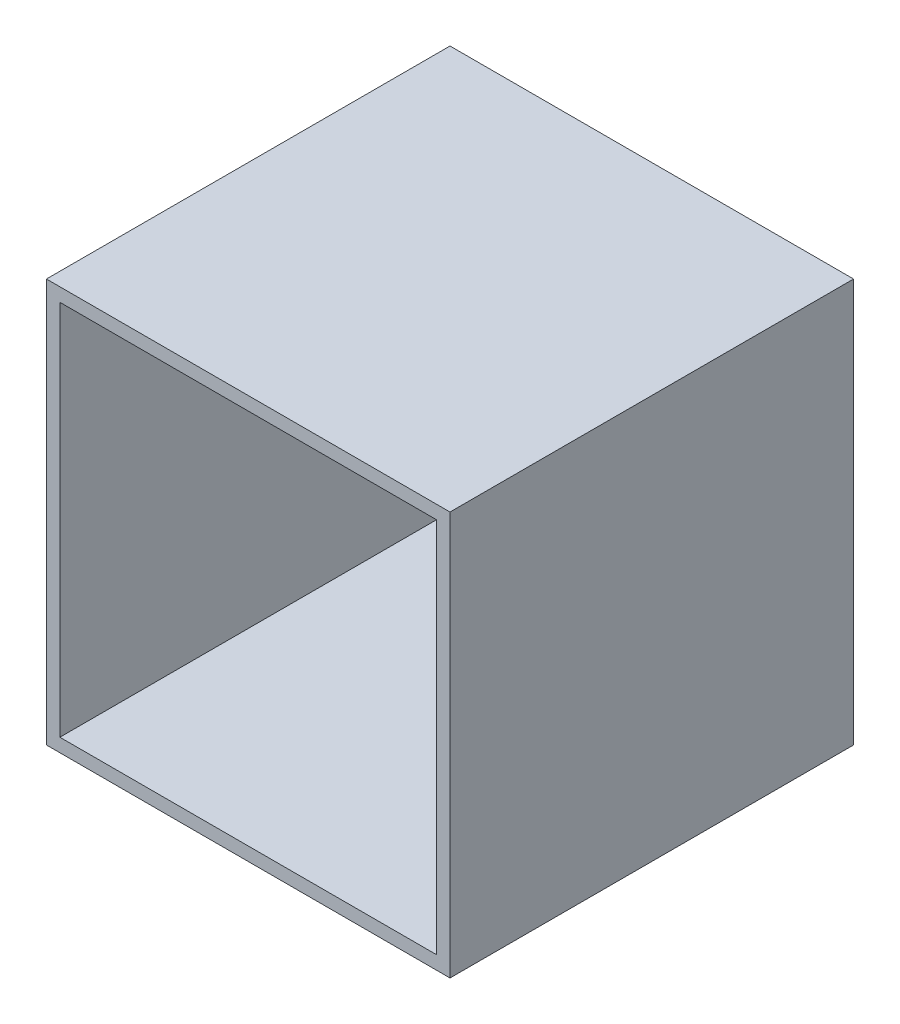
from build123d import *

# Parameters (mm, degrees)
SKETCH1_W               = 76.2
SKETCH1_H               = 76.2
BOX_DEPTH               = 76.2
HOLLOW_IT_T             = -2.54
SKETCH2_W               = 6.35
SKETCH2_H               = 63.5
SLIDER_TRACK_DEPTH      = 2.54
SKETCH4_R               = 6.35
BUTTON_LARGE_RING_DEPTH = 1.27
SKETCH5_R               = 3.175
BUTTON_SMALL_HOLE_DEPTH = 1.27
DPAD_LARGE_SHAPE_DEPTH  = 1.27
SKETCH7_R               = 1.397
DPAD_TINY_HOLES_DEPTH   = 1.27
SKETCH8_R               = 12.7
DIAL_LARGE_RING_DEPTH   = 1.27
SKETCH9_R               = 3.175
DIAL_SMALL_HOLE_DEPTH   = 1.27


with BuildPart() as part:
    # Sketch1 → box (new body)
    with BuildSketch(Plane(origin=(0, 0, 0), x_dir=(1, 0, 0), z_dir=(0, 1, 0))):
        Rectangle(SKETCH1_W, SKETCH1_H)
    extrude(amount=BOX_DEPTH)

    # hollow it
    hollow_it_openings = [part.faces().sort_by_distance(p)[0] for p in [
        (0, 38.1, 38.1),
    ]]
    offset(amount=HOLLOW_IT_T, openings=hollow_it_openings, kind=Kind.INTERSECTION)

    # Sketch2 → slider track (cut)
    with BuildSketch(Plane(origin=(0, 0, -38.1), x_dir=(-1, 0, 0), z_dir=(0, 0, -1))):
        with Locations((-24.765, 38.1)):
            Rectangle(SKETCH2_W, SKETCH2_H)
    extrude(amount=-SLIDER_TRACK_DEPTH, mode=Mode.SUBTRACT)

    # Sketch4 → button large ring (cut)
    with BuildSketch(Plane(origin=(0, 0, -38.1), x_dir=(-1, 0, 0), z_dir=(0, 0, -1))):
        with Locations((0, 57.15)):
            Circle(SKETCH4_R)
    extrude(amount=-BUTTON_LARGE_RING_DEPTH, mode=Mode.SUBTRACT)

    # Sketch5 → button small hole (cut)
    with BuildSketch(Plane(origin=(0, 0, -36.83), x_dir=(-1, 0, 0), z_dir=(0, 0, -1))):
        with Locations((0, 57.15)):
            Circle(SKETCH5_R)
    extrude(amount=-BUTTON_SMALL_HOLE_DEPTH, mode=Mode.SUBTRACT)

    # Sketch6 → dpad large shape (cut)
    with BuildSketch(Plane(origin=(0, 0, -38.1), x_dir=(-1, 0, 0), z_dir=(0, 0, -1))):
        Polygon((-3.297705804, 25.4), (-3.297705804, 31.75), (3.052294196, 31.75), (3.052294196, 25.4), (9.402294196, 25.4), (9.402294196, 19.05), (3.052294196, 19.05), (3.052294196, 12.7), (-3.297705804, 12.7), (-3.297705804, 19.05), (-9.647705804, 19.05), (-9.647705804, 25.4), align=None)
    extrude(amount=-DPAD_LARGE_SHAPE_DEPTH, mode=Mode.SUBTRACT)

    # Sketch7 → dpad tiny holes (cut)
    with BuildSketch(Plane(origin=(0, 0, -36.83), x_dir=(-1, 0, 0), z_dir=(0, 0, -1))):
        with Locations((-0.122705804, 28.575)):
            Circle(SKETCH7_R)
        with Locations((6.227294196, 22.225)):
            Circle(SKETCH7_R)
        with Locations((-0.122705804, 15.875)):
            Circle(SKETCH7_R)
        with Locations((-6.472705804, 22.225)):
            Circle(SKETCH7_R)
    extrude(amount=-DPAD_TINY_HOLES_DEPTH, mode=Mode.SUBTRACT)

    # Sketch8 → dial large ring (cut)
    with BuildSketch(Plane(origin=(0, 0, -38.1), x_dir=(-1, 0, 0), z_dir=(0, 0, -1))):
        with Locations((21.336, 43.050678032)):
            Circle(SKETCH8_R)
    extrude(amount=-DIAL_LARGE_RING_DEPTH, mode=Mode.SUBTRACT)

    # Sketch9 → dial small hole (cut)
    with BuildSketch(Plane(origin=(0, 0, -36.83), x_dir=(-1, 0, 0), z_dir=(0, 0, -1))):
        with Locations((21.336, 43.050678032)):
            Circle(SKETCH9_R)
    extrude(amount=-DIAL_SMALL_HOLE_DEPTH, mode=Mode.SUBTRACT)


solid = part.part
